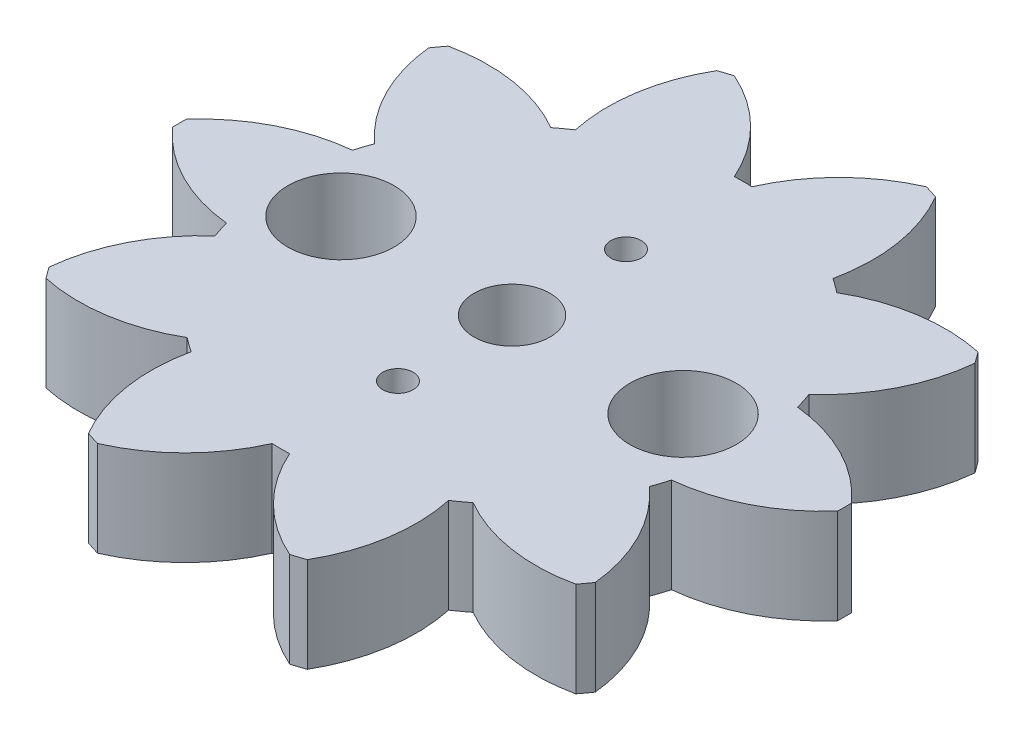
from build123d import *

# Parameters (mm, degrees)
SKETCH1_R           = 17.5
BOSS_EXTRUDE1_DEPTH = 5
CUT_EXTRUDE1_START  = -5
CUT_EXTRUDE1_DEPTH  = 5
CIRPATTERN1_COUNT   = 10
SKETCH3_R           = 2
CUT_EXTRUDE2_DEPTH  = 5
SKETCH4_R           = 0.8
SKETCH4_R_2         = 2.8
CUT_EXTRUDE3_DEPTH  = 5


with BuildPart() as part:
    # Sketch1 → Boss-Extrude1 (new body)
    with BuildSketch(Plane(origin=(0, 0, 0), x_dir=(1, 0, 0), z_dir=(0, 1, 0))):
        with Locations(Location((0, 0, 0), (0, 0, 270))):
            Circle(SKETCH1_R)
    extrude(amount=BOSS_EXTRUDE1_DEPTH)

    # Sketch2 → Cut-Extrude1 (cut)
    with BuildSketch(Plane(origin=(0, 5, 0), x_dir=(1, 0, 0), z_dir=(0, 1, 0)).offset(CUT_EXTRUDE1_START)):
        with BuildLine():
            ThreePointArc((-0.461351562, 12.161707059), (-2.330748839, 14.886662879), (-5.057656399, 16.753211983))
            ThreePointArc((-5.057656399, 16.753211983), (0, 17.5), (5.057656399, 16.753211983))
            ThreePointArc((5.057656399, 16.753211983), (2.330748839, 14.886662879), (0.461351562, 12.161707059))
            ThreePointArc((0.461351562, 12.161707059), (0, 12.170454545), (-0.461351562, 12.161707059))
        make_face()
    cut_extrude1 = extrude(amount=CUT_EXTRUDE1_DEPTH, mode=Mode.SUBTRACT)

    # CirPattern1: Cut-Extrude1 ×10 about axis
    cirpattern1_axis = Axis((0, 0, 0), (0, 1, 0))
    for i in range(1, CIRPATTERN1_COUNT):
        add(cut_extrude1.rotate(cirpattern1_axis, i * 360 / CIRPATTERN1_COUNT), mode=Mode.SUBTRACT)

    # Sketch3 → Cut-Extrude2 (cut)
    with BuildSketch(Plane(origin=(0, 5, 0), x_dir=(1, 0, 0), z_dir=(0, 1, 0))):
        with Locations(Location((0, 0, 0), (0, 0, 270))):
            Circle(SKETCH3_R)
    extrude(amount=-CUT_EXTRUDE2_DEPTH, mode=Mode.SUBTRACT)

    # Sketch4 → Cut-Extrude3 (cut)
    with BuildSketch(Plane(origin=(0, 5, 0), x_dir=(1, 0, 0), z_dir=(0, 1, 0))):
        with Locations(Location((0, 6, 0), (0, 0, 270))):
            Circle(SKETCH4_R)
        with Locations(Location((0, -6, 0), (0, 0, 270))):
            Circle(SKETCH4_R)
        with Locations(Location((-9, 0, 0), (0, 0, 270))):
            Circle(SKETCH4_R_2)
        with Locations(Location((9, 0, 0), (0, 0, 270))):
            Circle(SKETCH4_R_2)
    extrude(amount=-CUT_EXTRUDE3_DEPTH, mode=Mode.SUBTRACT)


solid = part.part
